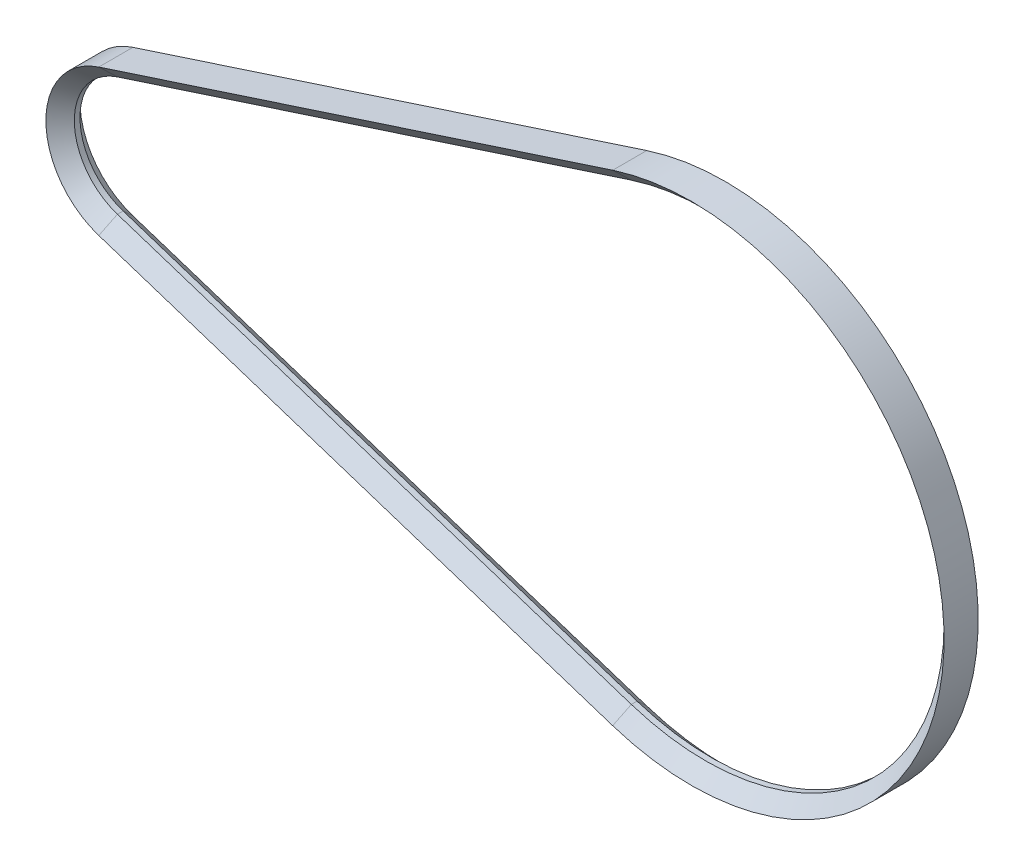
from build123d import *


with BuildPart() as part:
    # Balayage1: sweep along a path in Esquisse1
    with BuildLine(Plane.XY) as balayage1_path:
        Line((86.98, 39.930935376), (-3.41, 10.458102122))
        ThreePointArc((-3.41, 10.458102122), (-11, 0), (-3.41, -10.458102122))
        Line((-3.41, -10.458102122), (86.98, -39.930935376))
        ThreePointArc((86.98, -39.930935376), (142, 0), (86.98, 39.930935376))
    # Esquisse2 → Balayage1 (sweep)
    with BuildSketch(Plane(origin=(0, 0, 0), x_dir=(1, 0, 0), z_dir=(0, 1, 0))):
        Polygon((-13.5, -3), (-13.5, 3), (-11, 0.5), (-11, -0.5), align=None)
    sweep(path=balayage1_path.line)


solid = part.part
